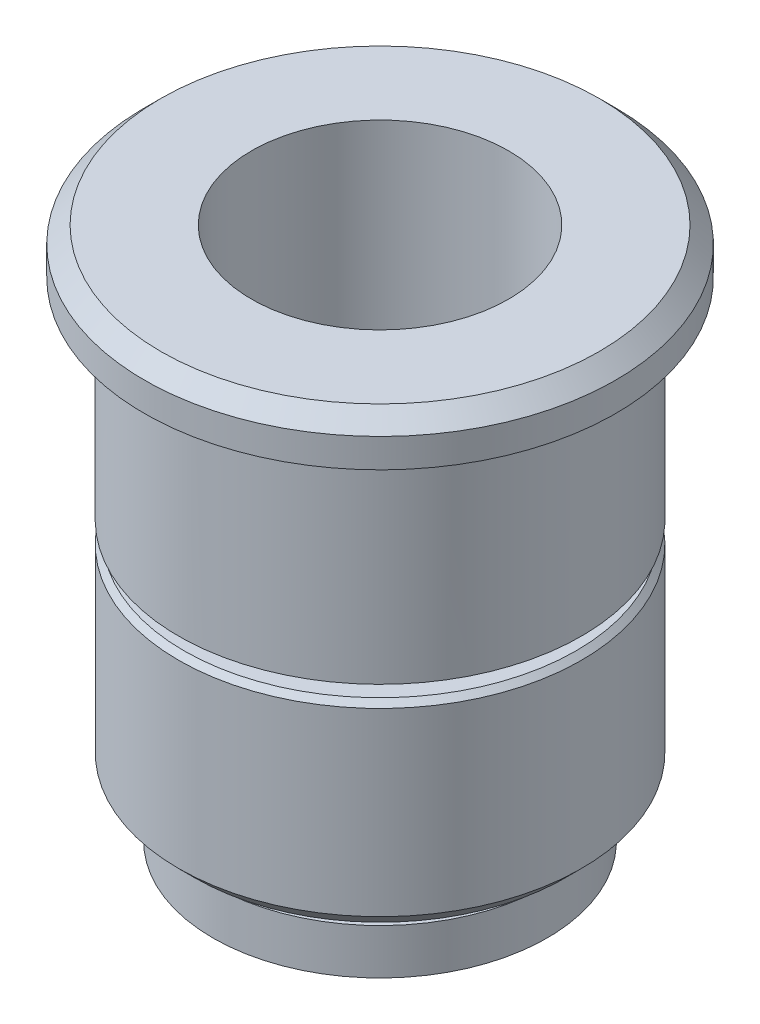
from build123d import *

# Parameters (mm, degrees)
SKETCH5_W     = 1.5
SKETCH5_H     = 6.23
CHAMFER1_SIZE = 0.0635
CHAMFER2_SIZE = 0.1925


with BuildPart() as part:
    # Sketch3 → Revolve1 (revolve)
    with BuildSketch(Plane.XY):
        Polygon((0, 0), (1.95, 0), (1.95, 0.53), (1.725, 0.53), (1.725, 0.71), (2.35, 0.71), (2.35, 3.07), (1.725, 3.07), (1.725, 3.25), (2.35, 3.25), (2.35, 5.61), (1.725, 5.61), (1.725, 5.7), (2.75, 5.7), (2.75, 6.23), (0, 6.23), align=None)
    revolve(axis=Axis((0, 0, 0), (0, 1, 0)))

    # Sketch5 → Cut-Revolve1 (revolve, cut)
    with BuildSketch(Plane.XY):
        with Locations((0.75, 3.115)):
            Rectangle(SKETCH5_W, SKETCH5_H)
    revolve(axis=Axis((0, 0, 0), (0, 1, 0)), mode=Mode.SUBTRACT)

    # Chamfer1
    chamfer1_edges = [part.edges().sort_by_distance(p)[0] for p in [
        (-2.35, 3.07, 0),
        (-2.35, 5.61, 0),
    ]]
    chamfer(chamfer1_edges, length=CHAMFER1_SIZE)

    # Chamfer2
    chamfer2_edges = [part.edges().sort_by_distance(p)[0] for p in [
        (-2.75, 6.23, 0),
        (-2.35, 0.71, 0),
    ]]
    chamfer(chamfer2_edges, length=CHAMFER2_SIZE)


solid = part.part
